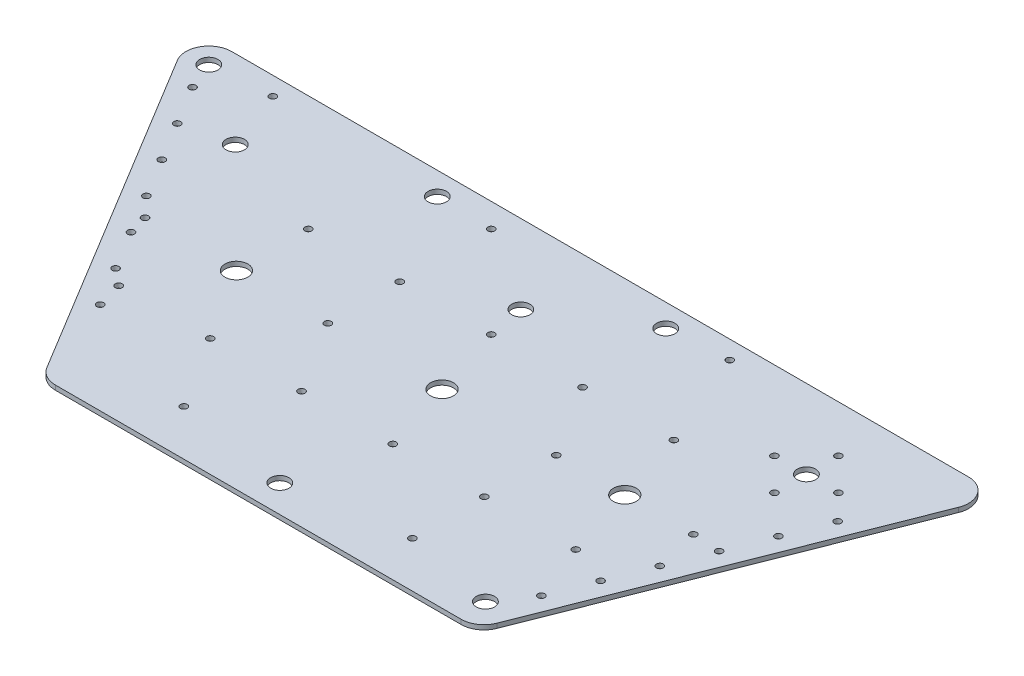
from build123d import *

# Parameters (mm, degrees)
BOSS_EXTRUDE1_DEPTH = 2
FILLET1_R           = 10
SKETCH3_R           = 1.5
SKETCH3_R_2         = 4
SKETCH3_R_3         = 5
CUT_EXTRUDE1_DEPTH  = 2


with BuildPart() as part:
    # Sketch2 → Boss-Extrude1 (new body)
    with BuildSketch(Plane(origin=(0, 0, 0), x_dir=(1, 0, 0), z_dir=(0, 1, 0))):
        Polygon((0, 0), (65, 165), (-290, 165), (-190, 0), align=None)
    extrude(amount=BOSS_EXTRUDE1_DEPTH)

    # Fillet1
    fillet1_edges = [part.edges().sort_by_distance(p)[0] for p in [
        (-190, 1, 0),
        (-290, 1, -165),
        (65, 1, -165),
        (0, 1, 0),
    ]]
    fillet(fillet1_edges, radius=FILLET1_R)

    # Sketch3 → Cut-Extrude1 (cut)
    with BuildSketch(Plane(origin=(0, 2, 0), x_dir=(1, 0, 0), z_dir=(0, 1, 0))):
        with Locations(Location((-228.170289346, 83, 0), (0, 0, 270))):
            Circle(SKETCH3_R)
        with Locations(Location((-246.246193102, 157, 0), (0, 0, 270))):
            Circle(SKETCH3_R)
        with Locations(Location((-46.246193102, 157, 0), (0, 0, 270))):
            Circle(SKETCH3_R)
        with Locations(Location((11.829710654, 83, 0), (0, 0, 270))):
            Circle(SKETCH3_R)
        with Locations(Location((13.829710654, 144.5, 0), (0, 0, 270))):
            Circle(SKETCH3_R)
        with Locations(Location((27.829710654, 130.5, 0), (0, 0, 270))):
            Circle(SKETCH3_R)
        with Locations(Location((13.829710654, 116.5, 0), (0, 0, 270))):
            Circle(SKETCH3_R)
        with Locations(Location((-0.170289346, 130.5, 0), (0, 0, 270))):
            Circle(SKETCH3_R)
        with Locations(Location((-272.246193102, 155, 0), (0, 0, 90))):
            Circle(SKETCH3_R_2)
        with Locations(Location((-172.246193102, 155, 0), (0, 0, 90))):
            Circle(SKETCH3_R_2)
        with Locations(Location((13.829710654, 130.5, 0), (0, 0, 90))):
            Circle(SKETCH3_R_2)
        with Locations(Location((-236.170289346, 130.5, 0), (0, 0, 90))):
            Circle(SKETCH3_R_2)
        with Locations(Location((-111.170289346, 130.5, 0), (0, 0, 90))):
            Circle(SKETCH3_R_2)
        with Locations(Location((-18.170289346, 83, 0), (0, 0, 90))):
            Circle(SKETCH3_R_3)
        with Locations(Location((-188.170289346, 83, 0), (0, 0, 90))):
            Circle(SKETCH3_R_3)
        with Locations(Location((-98.170289346, 83, 0), (0, 0, 90))):
            Circle(SKETCH3_R_3)
        with Locations(Location((-205.049987171, 40.267503937, 0), (0, 0, 90))):
            Circle(SKETCH3_R)
        with Locations(Location((-208.170289346, 51.5, 0), (0, 0, 90))):
            Circle(SKETCH3_R)
        with Locations(Location((-225.782055815, 74.475417199, 0), (0, 0, 90))):
            Circle(SKETCH3_R)
        with Locations(Location((-236.148090136, 91.57937383, 0), (0, 0, 90))):
            Circle(SKETCH3_R)
        with Locations(Location((-246.514124458, 108.683330462, 0), (0, 0, 90))):
            Circle(SKETCH3_R)
        with Locations(Location((-256.88015878, 125.787287093, 0), (0, 0, 90))):
            Circle(SKETCH3_R)
        with Locations(Location((-267.246193102, 142.891243724, 0), (0, 0, 90))):
            Circle(SKETCH3_R)
        with Locations(Location((1.829710654, 26.47129363, 0), (0, 0, 90))):
            Circle(SKETCH3_R)
        with Locations(Location((9.160201021, 45.079461487, 0), (0, 0, 90))):
            Circle(SKETCH3_R)
        with Locations(Location((16.490691389, 63.687629343, 0), (0, 0, 90))):
            Circle(SKETCH3_R)
        with Locations(Location((23.821181757, 82.295797199, 0), (0, 0, 90))):
            Circle(SKETCH3_R)
        with Locations(Location((31.151672124, 100.903965056, 0), (0, 0, 90))):
            Circle(SKETCH3_R)
        with Locations(Location((38.482162492, 119.512132912, 0), (0, 0, 90))):
            Circle(SKETCH3_R)
        with Locations(Location((-72.246193102, 155, 0), (0, 0, 90))):
            Circle(SKETCH3_R_2)
        with Locations(Location((-148.170289346, 154.5, 0), (0, 0, 90))):
            Circle(SKETCH3_R)
        with Locations(Location((-188.170289346, 114.5, 0), (0, 0, 90))):
            Circle(SKETCH3_R)
        with Locations(Location((-148.170289346, 114.5, 0), (0, 0, 90))):
            Circle(SKETCH3_R)
        with Locations(Location((-108.170289346, 114.5, 0), (0, 0, 90))):
            Circle(SKETCH3_R)
        with Locations(Location((-68.170289346, 114.5, 0), (0, 0, 90))):
            Circle(SKETCH3_R)
        with Locations(Location((-28.170289346, 114.5, 0), (0, 0, 90))):
            Circle(SKETCH3_R)
        with Locations(Location((-148.170289346, 83, 0), (0, 0, 90))):
            Circle(SKETCH3_R)
        with Locations(Location((-215.416021493, 57.371460568, 0), (0, 0, 90))):
            Circle(SKETCH3_R)
        with Locations(Location((-168.170289346, 51.5, 0), (0, 0, 90))):
            Circle(SKETCH3_R)
        with Locations(Location((-8.170289346, 51.5, 0), (0, 0, 90))):
            Circle(SKETCH3_R)
        with Locations(Location((-128.170289346, 51.5, 0), (0, 0, 90))):
            Circle(SKETCH3_R)
        with Locations(Location((-88.170289346, 51.5, 0), (0, 0, 90))):
            Circle(SKETCH3_R)
        with Locations(Location((-48.170289346, 83, 0), (0, 0, 90))):
            Circle(SKETCH3_R)
        with Locations(Location((-48.170289346, 51.5, 0), (0, 0, 90))):
            Circle(SKETCH3_R)
        with Locations(Location((-8.170289346, 12, 0), (0, 0, 90))):
            Circle(SKETCH3_R_2)
        with Locations(Location((-148.170289346, 20, 0), (0, 0, 90))):
            Circle(SKETCH3_R)
        with Locations(Location((-98.170289346, 12, 0), (0, 0, 90))):
            Circle(SKETCH3_R_2)
        with Locations(Location((-48.170289346, 20, 0), (0, 0, 90))):
            Circle(SKETCH3_R)
    extrude(amount=-CUT_EXTRUDE1_DEPTH, mode=Mode.SUBTRACT)


solid = part.part
